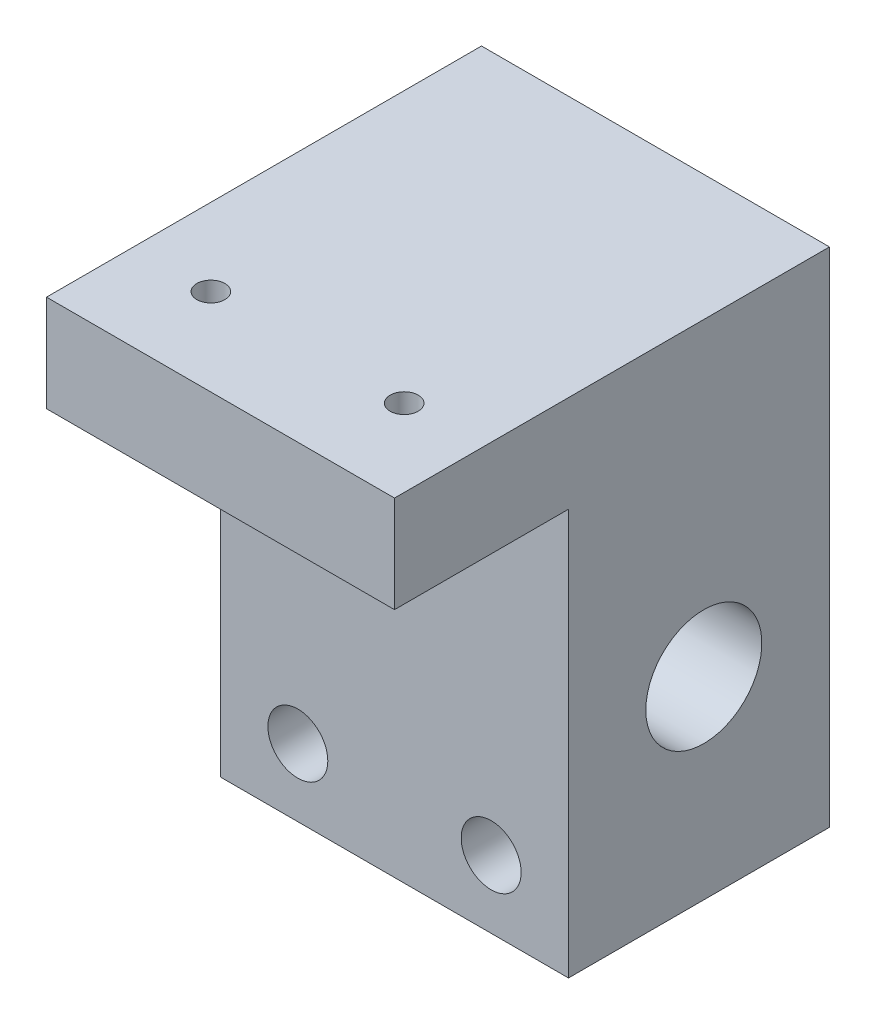
from build123d import *

# Parameters (mm, degrees)
SKETCH_1_W          = 36
SKETCH_1_H          = 24
EXTRUDE_1_DEPTH     = 55
SKETCH_2_R          = 6
CUT_EXTRUDE_1_DEPTH = 36
SKETCH_3_R          = 3.1
CUT_EXTRUDE_2_DEPTH = 6
SKETCH_5_W          = 18
SKETCH_5_H          = 10
EXTRUDE_2_DEPTH     = 36
SKETCH_6_R          = 1.45
CUT_EXTRUDE_3_DEPTH = 5
SKETCH_7_W          = 36
SKETCH_7_H          = 55
EXTRUDE_3_DEPTH     = 3
SKETCH_8_W          = 36
SKETCH_8_H          = 27
CUT_EXTRUDE_4_DEPTH = 3
SKETCH_9_R          = 1.45
CUT_EXTRUDE_5_DEPTH = 1.5


with BuildPart() as part:
    # 草图1 → 凸台-拉伸1 (new body)
    with BuildSketch(Plane(origin=(0, 0, 0), x_dir=(1, 0, 0), z_dir=(0, 1, 0))):
        with Locations((18, 12)):
            Rectangle(SKETCH_1_W, SKETCH_1_H)
    extrude(amount=EXTRUDE_1_DEPTH)

    # 草图2 → 切除-拉伸1 (cut)
    with BuildSketch(Plane.ZY):
        with Locations((-14, 23)):
            Circle(SKETCH_2_R)
    extrude(amount=-CUT_EXTRUDE_1_DEPTH, mode=Mode.SUBTRACT)

    # 草图3 → 切除-拉伸2 (cut)
    with BuildSketch(Plane.XY):
        with Locations((8, 10)):
            Circle(SKETCH_3_R)
        with Locations((28, 10)):
            Circle(SKETCH_3_R)
    extrude(amount=-CUT_EXTRUDE_2_DEPTH, mode=Mode.SUBTRACT)

    # 草图5 → 凸台-拉伸2 (add)
    with BuildSketch(Plane(origin=(36, 0, 0), x_dir=(0, 0, -1), z_dir=(1, 0, 0))):
        with Locations((-9, 50)):
            Rectangle(SKETCH_5_W, SKETCH_5_H)
    extrude(amount=-EXTRUDE_2_DEPTH)

    # 草图6 → 切除-拉伸3 (cut)
    with BuildSketch(Plane(origin=(0, 55, 0), x_dir=(1, 0, 0), z_dir=(0, 1, 0))):
        with Locations(Location((28, -9, 0), (0, 0, 270))):
            Circle(SKETCH_6_R)
        with Locations(Location((8, -9, 0), (0, 0, 270))):
            Circle(SKETCH_6_R)
    extrude(amount=-CUT_EXTRUDE_3_DEPTH, mode=Mode.SUBTRACT)

    # 草图7 → 凸台-拉伸3 (add)
    with BuildSketch(Plane(origin=(0, 0, -24), x_dir=(-1, 0, 0), z_dir=(0, 0, -1))):
        with Locations((-18, 27.5)):
            Rectangle(SKETCH_7_W, SKETCH_7_H)
    extrude(amount=EXTRUDE_3_DEPTH)

    # 草图8 → 切除-拉伸4 (cut)
    with BuildSketch(Plane.XZ):
        with Locations((18, -13.5)):
            Rectangle(SKETCH_8_W, SKETCH_8_H)
    extrude(amount=-CUT_EXTRUDE_4_DEPTH, mode=Mode.SUBTRACT)

    # 草图9 → 切除-拉伸5 (cut)
    with BuildSketch(Plane(origin=(0, 50, 0), x_dir=(1, 0, 0), z_dir=(0, 1, 0))):
        with Locations(Location((8, -9, 0), (0, 0, 270))):
            Circle(SKETCH_9_R)
    extrude(amount=-CUT_EXTRUDE_5_DEPTH, mode=Mode.SUBTRACT)


solid = part.part
